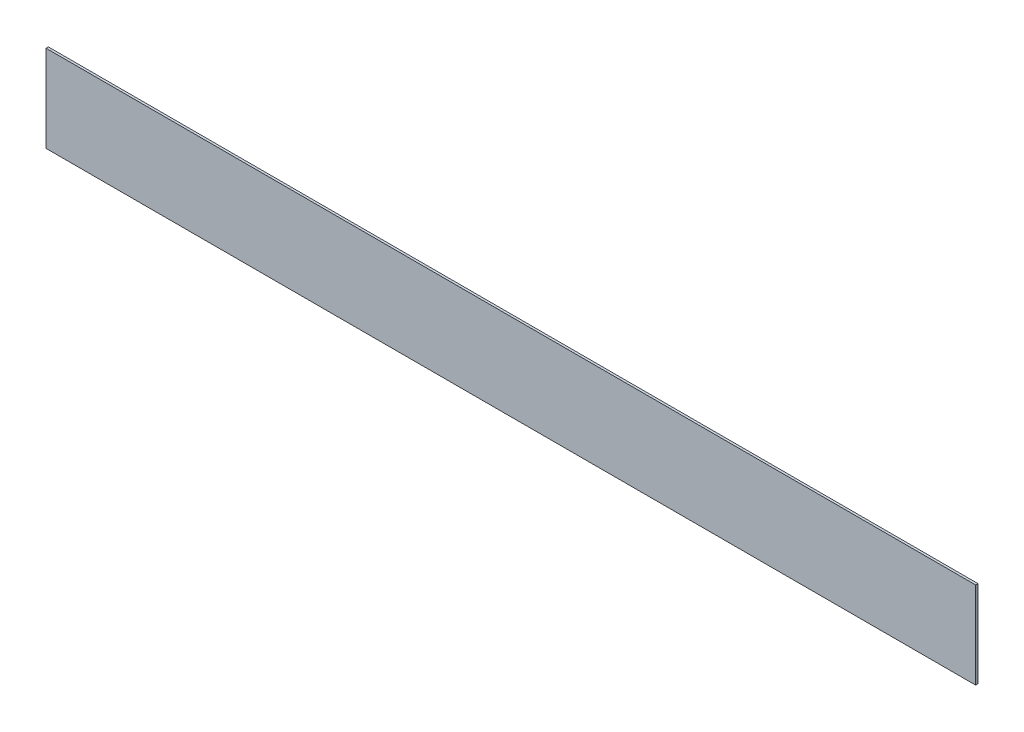
from build123d import *

# Parameters (mm, degrees)
SKETCH1_W           = 914.4
SKETCH1_H           = 85.344
BOSS_EXTRUDE1_DEPTH = 1.143


with BuildPart() as part:
    # Sketch1 → Boss-Extrude1 (new, symmetric)
    with BuildSketch(Plane.XY):
        Rectangle(SKETCH1_W, SKETCH1_H)
    extrude(amount=BOSS_EXTRUDE1_DEPTH, both=True)


solid = part.part
